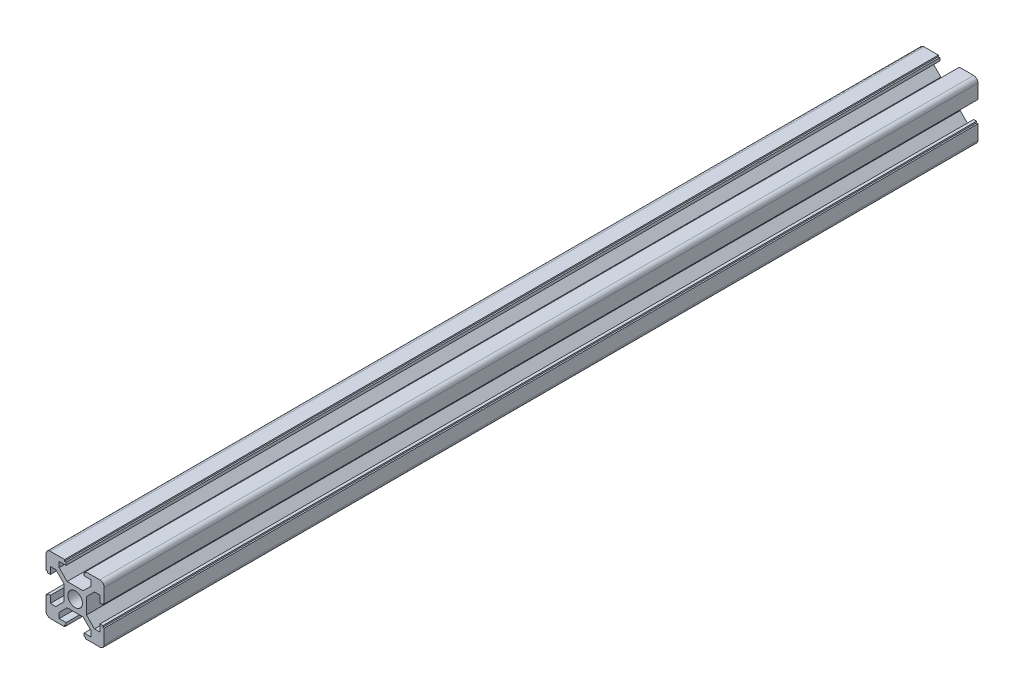
from build123d import *

# Parameters (mm, degrees)
SKETCH1_R       = 2.5
EXTRUDE_1_DEPTH = 300


with BuildPart() as part:
    # Sketch1 → 凸台-拉伸1 (new body)
    with BuildSketch(Plane.XY):
        with BuildLine():
            Line((-3.6, 10), (-3.6, 9.5))
            Line((-3.6, 9.5), (-3.1, 9.5))
            Line((-3.1, 9.5), (-3.1, 8.5))
            Line((-3.1, 8.5), (-5.5, 8.5))
            Line((-5.5, 8.5), (-5.5, 6.65))
            Line((-5.5, 6.65), (-2.75, 3.9))
            Line((-2.75, 3.9), (2.75, 3.9))
            Line((2.75, 3.9), (5.5, 6.65))
            Line((5.5, 6.65), (5.5, 8.5))
            Line((5.5, 8.5), (3.1, 8.5))
            Line((3.1, 8.5), (3.1, 9.5))
            Line((3.1, 9.5), (3.6, 9.5))
            Line((3.6, 9.5), (3.6, 10))
            Line((3.6, 10), (8.5, 10))
            ThreePointArc((8.5, 10), (9.560660172, 9.560660172), (10, 8.5))
            Line((10, 8.5), (10, 3.6))
            Line((10, 3.6), (9.5, 3.6))
            Line((9.5, 3.6), (9.5, 3.1))
            Line((9.5, 3.1), (8.5, 3.1))
            Line((8.5, 3.1), (8.5, 5.5))
            Line((8.5, 5.5), (6.65, 5.5))
            Line((6.65, 5.5), (3.9, 2.75))
            Line((3.9, 2.75), (3.9, -2.75))
            Line((3.9, -2.75), (6.65, -5.5))
            Line((6.65, -5.5), (8.5, -5.5))
            Line((8.5, -5.5), (8.5, -3.1))
            Line((8.5, -3.1), (9.5, -3.1))
            Line((9.5, -3.1), (9.5, -3.6))
            Line((9.5, -3.6), (10, -3.6))
            Line((10, -3.6), (10, -8.5))
            ThreePointArc((10, -8.5), (9.560660172, -9.560660172), (8.5, -10))
            Line((8.5, -10), (3.6, -10))
            Line((3.6, -10), (3.6, -9.5))
            Line((3.6, -9.5), (3.1, -9.5))
            Line((3.1, -9.5), (3.1, -8.5))
            Line((3.1, -8.5), (5.5, -8.5))
            Line((5.5, -8.5), (5.5, -6.65))
            Line((5.5, -6.65), (2.75, -3.9))
            Line((2.75, -3.9), (-2.75, -3.9))
            Line((-2.75, -3.9), (-5.5, -6.65))
            Line((-5.5, -6.65), (-5.5, -8.5))
            Line((-5.5, -8.5), (-3.1, -8.5))
            Line((-3.1, -8.5), (-3.1, -9.5))
            Line((-3.1, -9.5), (-3.6, -9.5))
            Line((-3.6, -9.5), (-3.6, -10))
            Line((-3.6, -10), (-8.5, -10))
            ThreePointArc((-8.5, -10), (-9.560660172, -9.560660172), (-10, -8.5))
            Line((-10, -8.5), (-10, -3.6))
            Line((-10, -3.6), (-9.5, -3.6))
            Line((-9.5, -3.6), (-9.5, -3.1))
            Line((-9.5, -3.1), (-8.5, -3.1))
            Line((-8.5, -3.1), (-8.5, -5.5))
            Line((-8.5, -5.5), (-6.65, -5.5))
            Line((-6.65, -5.5), (-3.9, -2.75))
            Line((-3.9, -2.75), (-3.9, 2.75))
            Line((-3.9, 2.75), (-6.65, 5.5))
            Line((-6.65, 5.5), (-8.5, 5.5))
            Line((-8.5, 5.5), (-8.5, 3.1))
            Line((-8.5, 3.1), (-9.5, 3.1))
            Line((-9.5, 3.1), (-9.5, 3.6))
            Line((-9.5, 3.6), (-10, 3.6))
            Line((-10, 3.6), (-10, 8.5))
            ThreePointArc((-10, 8.5), (-9.560660172, 9.560660172), (-8.5, 10))
            Line((-8.5, 10), (-3.6, 10))
        make_face()
        Circle(SKETCH1_R, mode=Mode.SUBTRACT)
    extrude(amount=EXTRUDE_1_DEPTH)


solid = part.part
